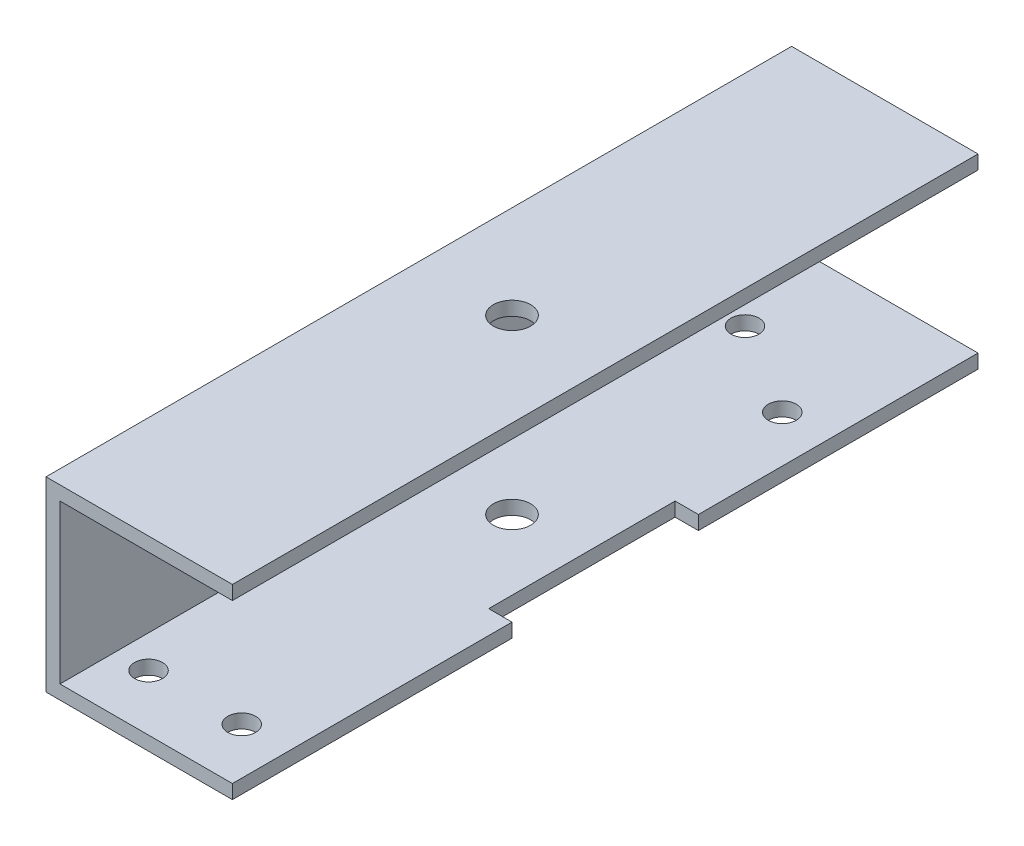
from build123d import *

# Parameters (mm, degrees)
EXTRUSION1_DEPTH = 80
ESQUISSE2_R      = 1.5
ESQUISSE2_W      = 2.5
ESQUISSE2_H      = 20
EXTRUSION2_DEPTH = 10
ESQUISSE3_R      = 2
EXTRUSION3_DEPTH = 88.508383337


with BuildPart() as part:
    # Esquisse1 → Extrusion1 (new body)
    with BuildSketch(Plane.XY):
        Polygon((-29.286808535, 30.629808714), (-29.286808535, 10.629808714), (-9.286808535, 10.629808714), (-9.286808535, 12.129808714), (-27.786808535, 12.129808714), (-27.786808535, 29.129808714), (-9.286808535, 29.129808714), (-9.286808535, 30.629808714), align=None)
    extrude(amount=EXTRUSION1_DEPTH)

    # Esquisse2 → Extrusion2 (cut)
    with BuildSketch(Plane.XZ.offset(-10.629808714)):
        with Locations(Location((-14.286808535, 74, 0), (0, 0, 270))):
            Circle(ESQUISSE2_R)
        with Locations(Location((-24.286808535, 74, 0), (0, 0, 270))):
            Circle(ESQUISSE2_R)
        with Locations(Location((-14.286808535, 16, 0), (0, 0, 270))):
            Circle(ESQUISSE2_R)
        with Locations(Location((-24.286808535, 10, 0), (0, 0, 270))):
            Circle(ESQUISSE2_R)
        with Locations((-10.536808535, 40)):
            Rectangle(ESQUISSE2_W, ESQUISSE2_H)
    extrude(amount=-EXTRUSION2_DEPTH, mode=Mode.SUBTRACT)

    # Esquisse3 → Extrusion3 (cut, through all)
    with BuildSketch(Plane.XZ.offset(-10.629808714)):
        with Locations(Location((-19.286808535, 40, 0), (0, 0, 270))):
            Circle(ESQUISSE3_R)
    extrude(amount=-EXTRUSION3_DEPTH, mode=Mode.SUBTRACT)


solid = part.part
